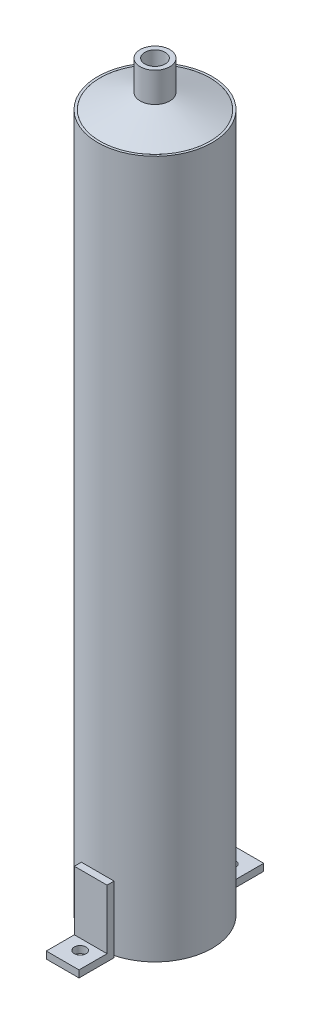
from build123d import *

# Parameters (mm, degrees)
SKETCH1_R             = 24.5
SKETCH1_R_2           = 23.5
EXTRUDE_THIN1_DEPTH   = 298.45
SKETCH7_W             = 3.048
SKETCH7_H             = 2.286
BOSS_EXTRUDE1_DEPTH   = 261.62
SKETCH7_W_2           = 2.286
SKETCH7_H_2           = 3.048
BOSS_EXTRUDE1_2_DEPTH = 261.62
BOSS_EXTRUDE1_3_DEPTH = 261.62
BOSS_EXTRUDE1_4_DEPTH = 261.62
SKETCH10_R            = 6.35
SKETCH9_R             = 23.5
SKETCH11_R            = 6.35
SKETCH11_R_2          = 4.35
EXTRUDE_THIN2_DEPTH   = 12.7
SKETCH12_W            = 14
SKETCH12_H            = 15
BOSS_EXTRUDE2_DEPTH   = 3
BOSS_EXTRUDE2_2_DEPTH = 3
SKETCH13_W            = 14
SKETCH13_H            = 3
BOSS_EXTRUDE3_DEPTH   = 25.4
SKETCH14_R            = 2.51866319
CUT_EXTRUDE2_DEPTH    = 3


with BuildPart() as part:
    # Sketch1 → Extrude-Thin1 (new body)
    with BuildSketch(Plane(origin=(0, 0, 0), x_dir=(1, 0, 0), z_dir=(0, 1, 0))):
        Circle(SKETCH1_R)
        Circle(SKETCH1_R_2, mode=Mode.SUBTRACT)
    extrude(amount=EXTRUDE_THIN1_DEPTH)


with BuildPart() as body_2:
    # Sketch7 → Boss-Extrude1 (new body)
    with BuildSketch(Plane.XZ):
        with Locations((0, -22.357)):
            Rectangle(SKETCH7_W, SKETCH7_H)
    extrude(amount=-BOSS_EXTRUDE1_DEPTH)


with BuildPart() as body_3:
    # Sketch7 → Boss-Extrude1 2 (new body)
    with BuildSketch(Plane.XZ):
        with Locations((-22.357, 0)):
            Rectangle(SKETCH7_W_2, SKETCH7_H_2)
    extrude(amount=-BOSS_EXTRUDE1_2_DEPTH)


with BuildPart() as body_4:
    # Sketch7 → Boss-Extrude1 3 (new body)
    with BuildSketch(Plane.XZ):
        with Locations((0, 22.357)):
            Rectangle(SKETCH7_W, SKETCH7_H)
    extrude(amount=-BOSS_EXTRUDE1_3_DEPTH)


with BuildPart() as body_5:
    # Sketch7 → Boss-Extrude1 4 (new body)
    with BuildSketch(Plane.XZ):
        with Locations((22.357, 0)):
            Rectangle(SKETCH7_W_2, SKETCH7_H_2)
    extrude(amount=-BOSS_EXTRUDE1_4_DEPTH)


with BuildPart() as body_6:
    # Sketch10 → Loft1 section 0
    with BuildSketch(Plane(origin=(0, 304.8, 0), x_dir=(1, 0, 0), z_dir=(0, 1, 0))):
        Circle(SKETCH10_R)
    # Sketch9 → Loft1 section 1
    with BuildSketch(Plane(origin=(0, 298.45, 0), x_dir=(1, 0, 0), z_dir=(0, 1, 0))):
        Circle(SKETCH9_R)
    loft()


with BuildPart() as body_7:
    # Sketch11 → Extrude-Thin2 (new body)
    with BuildSketch(Plane(origin=(0, 304.8, 0), x_dir=(1, 0, 0), z_dir=(0, 1, 0))):
        Circle(SKETCH11_R)
        Circle(SKETCH11_R_2, mode=Mode.SUBTRACT)
    extrude(amount=EXTRUDE_THIN2_DEPTH)


with BuildPart() as body_8:
    # Sketch12 → Boss-Extrude2 (new body)
    with BuildSketch(Plane.XZ):
        with Locations((0, 32)):
            Rectangle(SKETCH12_W, SKETCH12_H)
    extrude(amount=-BOSS_EXTRUDE2_DEPTH)

    # Sketch13 → Boss-Extrude3 (add)
    with BuildSketch(Plane(origin=(0, 3, 0), x_dir=(1, 0, 0), z_dir=(0, 1, 0))):
        with Locations((0, -26)):
            Rectangle(SKETCH13_W, SKETCH13_H)
        with Locations((0, 26)):
            Rectangle(SKETCH13_W, SKETCH13_H)
    extrude(amount=BOSS_EXTRUDE3_DEPTH)


with BuildPart() as body_9:
    # Sketch12 → Boss-Extrude2 2 (new body)
    with BuildSketch(Plane.XZ):
        with Locations((0, -32)):
            Rectangle(SKETCH12_W, SKETCH12_H)
    extrude(amount=-BOSS_EXTRUDE2_2_DEPTH)


with BuildPart() as boss_extrude3_piece_1:
    # of the separate pieces the step leaves, piece 1, a body of its own (boss_extrude3_pieces)
    add(body_8.part.solids().sort_by_distance((-7, 0, 39.5))[0])


with BuildPart() as boss_extrude3_piece_2:
    # of the separate pieces the step leaves, piece 2, a body of its own (boss_extrude3_pieces)
    add(body_8.part.solids().sort_by_distance((-7, 3, -24.5))[0])


with BuildPart() as cut_extrude2_tool:
    # Sketch14 → Cut-Extrude2 (new body)
    with BuildSketch(Plane(origin=(0, 3, 0), x_dir=(1, 0, 0), z_dir=(0, 1, 0))):
        with Locations(Location((0, -32, 0), (0, 0, 270))):
            Circle(SKETCH14_R)
        with Locations(Location((0, 32, 0), (0, 0, 270))):
            Circle(SKETCH14_R)
    extrude(amount=-CUT_EXTRUDE2_DEPTH)


with BuildPart() as body_9_1:
    add(body_9.part)

    # Cut-Extrude2: cut by cut_extrude2_tool
    add(cut_extrude2_tool.part, mode=Mode.SUBTRACT)


with BuildPart() as boss_extrude3_piece_1_1:
    add(boss_extrude3_piece_1.part)

    # Cut-Extrude2: cut by cut_extrude2_tool
    add(cut_extrude2_tool.part, mode=Mode.SUBTRACT)


solid = Compound([part.part, body_2.part, body_3.part, body_4.part, body_5.part, body_6.part, body_7.part, boss_extrude3_piece_2.part, body_9_1.part, boss_extrude3_piece_1_1.part])
